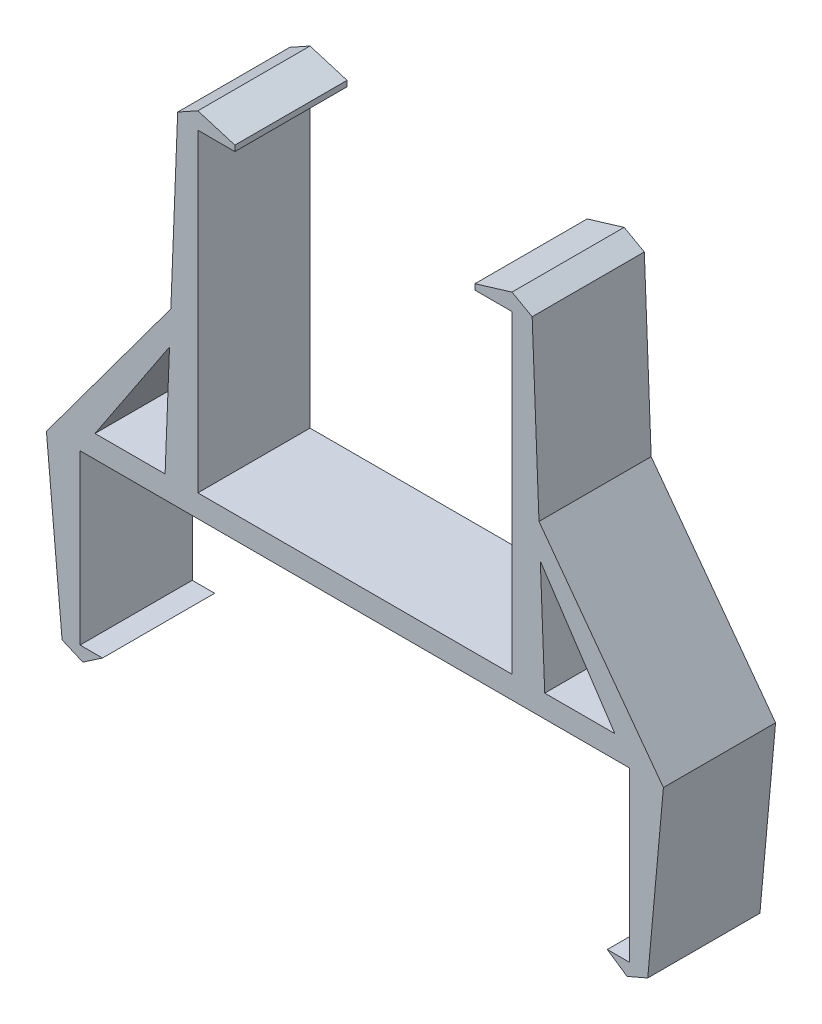
from build123d import *

# Parameters (mm, degrees)
AUFSATZ_LINEAR_AUSTRAGEN1_DEPTH = 10
AUFSATZ_LINEAR_AUSTRAGEN2_DEPTH = 10
AUFSATZ_LINEAR_AUSTRAGEN3_DEPTH = 10


with BuildPart() as part:
    # Skizze1 → Aufsatz-Linear austragen1 (new body)
    with BuildSketch(Plane.XY):
        Polygon((0, 29.5), (-1.8, 28.5), (-3, -2), (31, -2), (29.8, 28.5), (28, 29.5), (24.7, 28.5), (24.7, 28), (28, 28), (28, 0), (0, 0), (0, 28), (3.3, 28), (3.3, 28.5), align=None)
    extrude(amount=AUFSATZ_LINEAR_AUSTRAGEN1_DEPTH)

    # Skizze1<3> → Aufsatz-Linear austragen2 (add)
    with BuildSketch(Plane.XY):
        Polygon((-2.527868852, 10), (-2.409836066, 13), (-13.5, -2), (-12.105255888, -17.4), (-10.257932824, -18.2), (-8.5, -17), (-10.5, -17), (-10.5, -2), align=None)
        Polygon((30.527868852, 10), (38.5, -2), (38.5, -17), (36.5, -17), (38.257932824, -18.2), (40.105255888, -17.4), (41.5, -2), (30.409836066, 13), align=None)
    extrude(amount=AUFSATZ_LINEAR_AUSTRAGEN2_DEPTH)

    # Skizze1<4> → Aufsatz-Linear austragen3 (add)
    with BuildSketch(Plane.XY):
        Polygon((-3, -2), (-2.921311475, 0), (-9.171311475, 0), (-10.5, -2), align=None)
        Polygon((30.921311475, 0), (31, -2), (38.5, -2), (37.171311475, 0), align=None)
    extrude(amount=AUFSATZ_LINEAR_AUSTRAGEN3_DEPTH)


solid = part.part
